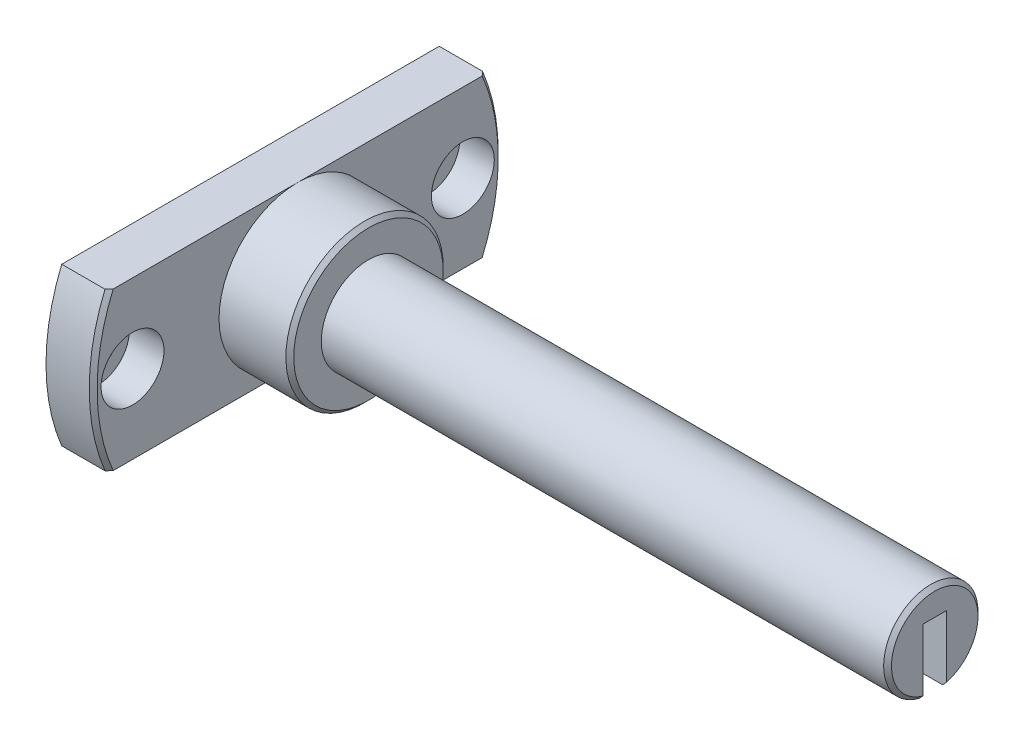
from build123d import *

# Parameters (mm, degrees)
CHANFREIN1_SIZE                                    = 0.5
CHAMBRAGE_POUR_VIS_T_TE_HEXAGONALE_M41_D           = 4.5
CHAMBRAGE_POUR_VIS_T_TE_HEXAGONALE_M41_CBORE_D     = 8
CHAMBRAGE_POUR_VIS_T_TE_HEXAGONALE_M41_CBORE_DEPTH = 4.4
ENL_V_MAT_EXTRU_2_DEPTH                            = 95.451045521
CHANFREIN3_SIZE                                    = 0.5
ESQUISSE12_W                                       = 3
ESQUISSE12_H                                       = 11.621091342
ENL_V_MAT_EXTRU_3_DEPTH                            = 3
D_GAGEMENT_M21_D                                   = 2.4
D_GAGEMENT_M21_DEPTH                               = 5
D_GAGEMENT_M21_TIP                                 = 0.692820323


with BuildPart() as part:
    # Esquisse1 → Révolution1 (revolve)
    with BuildSketch(Plane.XY):
        Polygon((15, 6), (87, 6), (87, 0), (0, 0), (0, 26), (6, 26), (6, 10), (15, 10), align=None)
    revolve(axis=Axis((87, 0, 0), (-1, 0, 0)))

    # Chanfrein1
    chanfrein1_edges = [part.edges().sort_by_distance(p)[0] for p in [
        (6, -26, 0),
        (15, -10, 0),
    ]]
    chamfer(chanfrein1_edges, length=CHANFREIN1_SIZE)

    # Chambrage pour vis à tête hexagonale M41 (through all)
    with Locations(Plane(origin=(6, 0, 0), x_dir=(0, 0, -1), z_dir=(1, 0, 0))):
        with Locations((-21, 0), (21, 0)):
            CounterBoreHole(CHAMBRAGE_POUR_VIS_T_TE_HEXAGONALE_M41_D / 2, CHAMBRAGE_POUR_VIS_T_TE_HEXAGONALE_M41_CBORE_D / 2, CHAMBRAGE_POUR_VIS_T_TE_HEXAGONALE_M41_CBORE_DEPTH)

    # Esquisse11 → Enlèv. mat.-Extru.2 (cut, through all)
    with BuildSketch(Plane.ZY):
        with BuildLine():
            Line((24, -10), (-24, -10))
            ThreePointArc((-24, -10), (0, -26), (24, -10))
        make_face()
        with BuildLine():
            Line((24, 10), (-24, 10))
            ThreePointArc((-24, 10), (0, 26), (24, 10))
        make_face()
    extrude(amount=-ENL_V_MAT_EXTRU_2_DEPTH, mode=Mode.SUBTRACT)

    # Chanfrein3
    chanfrein3_edges = [part.edges().sort_by_distance(p)[0] for p in [
        (87, -6, 0),
    ]]
    chamfer(chanfrein3_edges, length=CHANFREIN3_SIZE)

    # Esquisse12 → Enlèv. mat.-Extru.3 (cut)
    with BuildSketch(Plane(origin=(87, 0, 0), x_dir=(0, 0, -1), z_dir=(1, 0, 0))):
        with Locations((0, -3.191920072)):
            Rectangle(ESQUISSE12_W, ESQUISSE12_H)
    extrude(amount=-ENL_V_MAT_EXTRU_3_DEPTH, mode=Mode.SUBTRACT)

    # Dégagement M21
    with Locations(Plane(origin=(84, 0, 0), x_dir=(0, 0, -1), z_dir=(1, 0, 0))):
        with Locations((0, 0), (0, -3.724850959)):
            Hole(D_GAGEMENT_M21_D / 2, depth=D_GAGEMENT_M21_DEPTH)
            with Locations((0, 0, -(D_GAGEMENT_M21_DEPTH + D_GAGEMENT_M21_TIP / 2))):  # 120° drill point
                Cone(0, D_GAGEMENT_M21_D / 2, D_GAGEMENT_M21_TIP, mode=Mode.SUBTRACT)


solid = part.part
